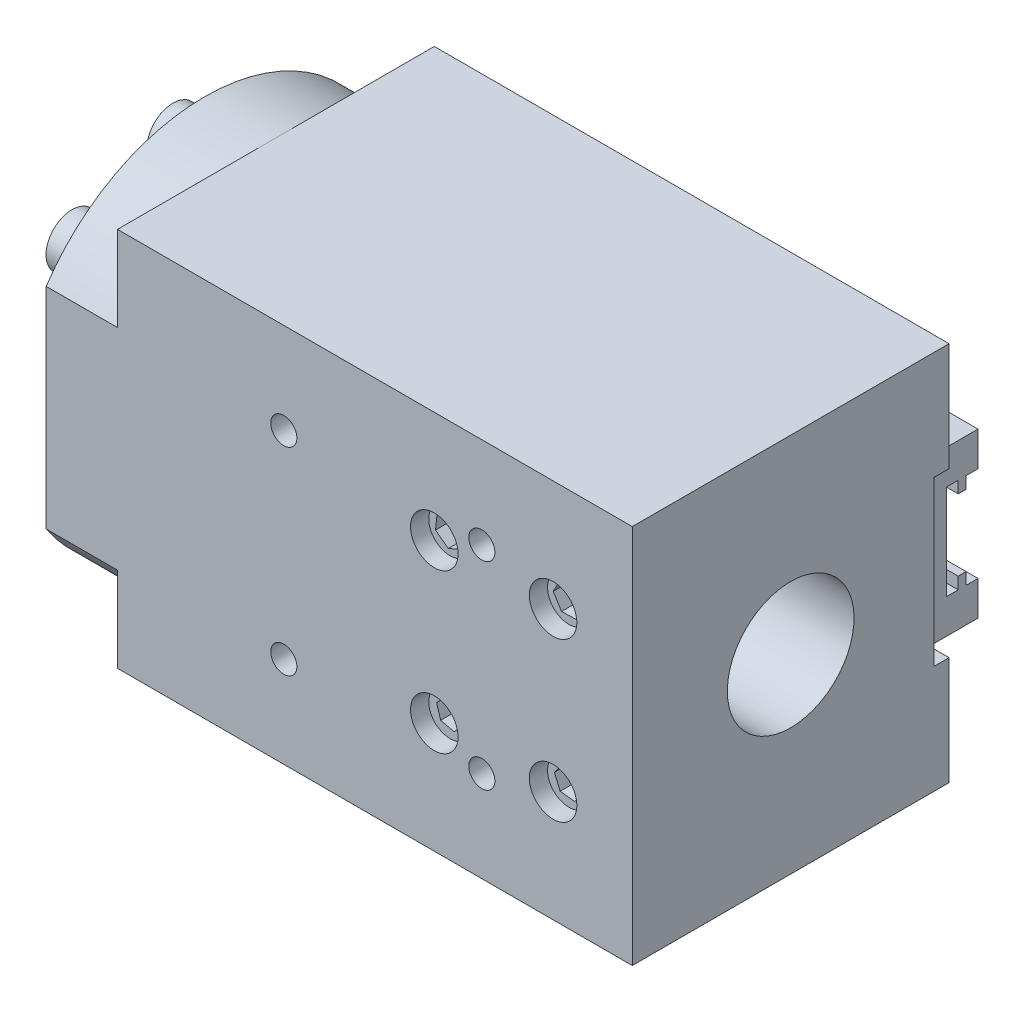
from build123d import *

# Parameters (mm, degrees)
SKETCH_1_W                  = 65
SKETCH_1_H                  = 48
EXTRUDE_1_DEPTH             = 40
SKETCH_2_R                  = 3
CUT_EXTRUDE_1_DEPTH         = 6
HOLE_WIZARD_3_3_3_3_1_D     = 3.3
HOLE_WIZARD_3_3_3_3_1_DEPTH = 10
HOLE_WIZARD_3_3_3_3_1_TIP   = 0.991420021
SKETCH_5_R                  = 2.7
EXTRUDE_2_DEPTH             = 4
CUT_EXTRUDE_2_DEPTH         = 4
EXTRUDE_3_DEPTH             = 9
SKETCH_8_R                  = 3.3
EXTRUDE_4_DEPTH             = 4
CUT_EXTRUDE_3_DEPTH         = 4
SKETCH_11_R                 = 8
CUT_EXTRUDE_4_DEPTH         = 88.475710915
SKETCH_12_W                 = 1.91
SKETCH_12_H                 = 20.67
CUT_EXTRUDE_5_DEPTH         = 2.5
EXTRUDE_5_DEPTH             = 30


with BuildPart() as part:
    # 草图1 → 凸台-拉伸1 (new body)
    with BuildSketch(Plane.XY):
        Rectangle(SKETCH_1_W, SKETCH_1_H)
    extrude(amount=EXTRUDE_1_DEPTH)

    # 草图2 → 切除-拉伸1 (cut)
    with BuildSketch(Plane.XY.offset(40)):
        with Locations((22.5, 10)):
            Circle(SKETCH_2_R)
        with Locations((22.5, -10)):
            Circle(SKETCH_2_R)
        with Locations((7.5, 10)):
            Circle(SKETCH_2_R)
        with Locations((7.5, -10)):
            Circle(SKETCH_2_R)
    extrude(amount=-CUT_EXTRUDE_1_DEPTH, mode=Mode.SUBTRACT)

    # Ø3.3 (3.3) 直径孔1
    with Locations(Plane.XY.offset(40)):
        with Locations((13.5, -12.5), (-11.5, -12.5), (13.5, 12.5), (-11.5, 12.5)):
            Hole(HOLE_WIZARD_3_3_3_3_1_D / 2, depth=HOLE_WIZARD_3_3_3_3_1_DEPTH)
            with Locations((0, 0, -(HOLE_WIZARD_3_3_3_3_1_DEPTH + HOLE_WIZARD_3_3_3_3_1_TIP / 2))):  # 118° drill point
                Cone(0, HOLE_WIZARD_3_3_3_3_1_D / 2, HOLE_WIZARD_3_3_3_3_1_TIP, mode=Mode.SUBTRACT)

    # 草图5 → 凸台-拉伸2 (add)
    with BuildSketch(Plane.XY.offset(34)):
        with Locations((22.5, 10)):
            Circle(SKETCH_5_R)
        with Locations((7.5, 10)):
            Circle(SKETCH_5_R)
        with Locations((7.5, -10)):
            Circle(SKETCH_5_R)
        with Locations((22.5, -10)):
            Circle(SKETCH_5_R)
    extrude(amount=EXTRUDE_2_DEPTH)

    # 草图6 → 切除-拉伸2 (cut)
    with BuildSketch(Plane.XY.offset(38)):
        Polygon((24.341579714, -10.210975793), (23.603500253, -8.510633081), (21.761920539, -8.299657288), (20.658420286, -9.789024207), (21.396499747, -11.489366919), (23.238079461, -11.700342712), align=None)
        Polygon((5.794848806, -9.606351162), (6.30651451, -11.279879832), (8.011665703, -11.67352867), (9.205151194, -10.393648838), (8.69348549, -8.720120168), (6.988334297, -8.32647133), align=None)
        Polygon((21.45041022, 11.682057174), (20.518500867, 9.932057174), (21.568090646, 8.25), (23.54958978, 8.317942826), (24.481499133, 10.067942826), (23.431909354, 11.75), align=None)
        Polygon((5.873282152, 11.19880039), (5.648449484, 9.190621214), (7.275167332, 7.991820824), (9.126717848, 8.80119961), (9.351550516, 10.809378786), (7.724832668, 12.008179176), align=None)
    extrude(amount=-CUT_EXTRUDE_2_DEPTH, mode=Mode.SUBTRACT)

    # 草图7 → 凸台-拉伸3 (add)
    with BuildSketch(Plane.ZY.offset(32.5)):
        with BuildLine():
            Line((0, 13.266499161), (0, -13.266499161))
            ThreePointArc((0, -13.266499161), (20, -24), (40, -13.266499161))
            Line((40, -13.266499161), (40, 13.266499161))
            ThreePointArc((40, 13.266499161), (20, 24), (0, 13.266499161))
        make_face()
    extrude(amount=EXTRUDE_3_DEPTH)

    # 草图8 → 凸台-拉伸4 (add)
    with BuildSketch(Plane.ZY.offset(41.5)):
        with Locations(Location((20, 18, 0), (0, 0, 270))):
            Circle(SKETCH_8_R)
        with Locations(Location((32.727922061, 12.727922061, 0), (0, 0, 270))):
            Circle(SKETCH_8_R)
        with Locations(Location((7.272077939, 12.727922061, 0), (0, 0, 270))):
            Circle(SKETCH_8_R)
    extrude_4 = extrude(amount=EXTRUDE_4_DEPTH)

    # 草图9 → 切除-拉伸3 (cut)
    with BuildSketch(Plane.ZY.offset(45.5)):
        Polygon((5.811063185, 11.764627771), (7.375807889, 10.980999024), (8.836822642, 11.944293315), (8.733092692, 13.691216352), (7.168347989, 14.474845098), (5.707333235, 13.511550808), align=None)
        Polygon((31.486883058, 11.494097847), (33.175925673, 11.03623865), (34.416964676, 12.270062864), (33.968961065, 13.961746275), (32.27991845, 14.419605473), (31.038879446, 13.185781259), align=None)
        Polygon((18.478401074, 17.135571455), (19.987817617, 16.250042404), (21.509416543, 17.114470949), (21.521598926, 18.864428545), (20.012182383, 19.749957596), (18.490583457, 18.885529051), align=None)
    cut_extrude_3 = extrude(amount=-CUT_EXTRUDE_3_DEPTH, mode=Mode.SUBTRACT)

    # 镜向1: 凸台-拉伸4, 切除-拉伸3 across plane
    add(extrude_4.mirror(Plane.ZX))
    add(cut_extrude_3.mirror(Plane.ZX), mode=Mode.SUBTRACT)

    # 草图11 → 切除-拉伸4 (cut, through all)
    with BuildSketch(Plane.ZY.offset(41.5)):
        with Locations(Location((20, 0, 0), (0, 0, 270))):
            Circle(SKETCH_11_R)
    extrude(amount=-CUT_EXTRUDE_4_DEPTH, mode=Mode.SUBTRACT)

    # 草图12 → 切除-拉伸5 (cut)
    with BuildSketch(Plane(origin=(32.5, 0, 0), x_dir=(0, 0, -1), z_dir=(1, 0, 0))):
        with Locations((-0.955, 0)):
            Rectangle(SKETCH_12_W, SKETCH_12_H)
    extrude(amount=-CUT_EXTRUDE_5_DEPTH, mode=Mode.SUBTRACT)

    # 草图13 → 凸台-拉伸5 (add)
    with BuildSketch(Plane(origin=(30, 0, 0), x_dir=(0, 0, -1), z_dir=(1, 0, 0))):
        Polygon((-1.91, 10.335), (6.15, 10.335), (6.15, 5.995), (4.65, 5.995), (4.65, 4.495), (3.65, 4.495), (3.65, 5.995), (2.15, 5.995), (2.15, -5.995), (3.65, -5.995), (3.65, -4.495), (4.65, -4.495), (4.65, -5.995), (6.15, -5.995), (6.15, -10.335), (-1.91, -10.335), align=None)
    extrude(amount=-EXTRUDE_5_DEPTH)


solid = part.part
